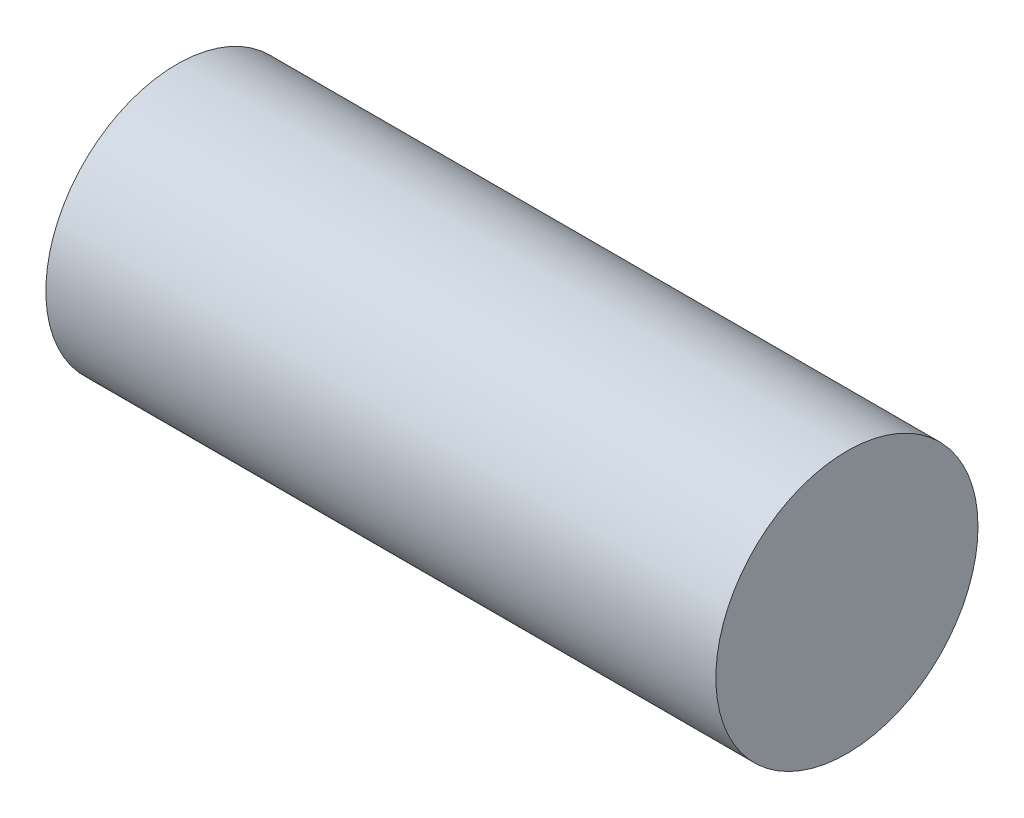
from build123d import *

# Parameters (mm, degrees)
SKETCH1_R           = 7.825
BOSS_EXTRUDE1_DEPTH = 40


with BuildPart() as part:
    # Sketch1 → Boss-Extrude1 (new body)
    with BuildSketch(Plane.YZ):
        with Locations(Location((0, 0, 0), (0, 0, 270))):
            Circle(SKETCH1_R)
    extrude(amount=BOSS_EXTRUDE1_DEPTH)


solid = part.part
